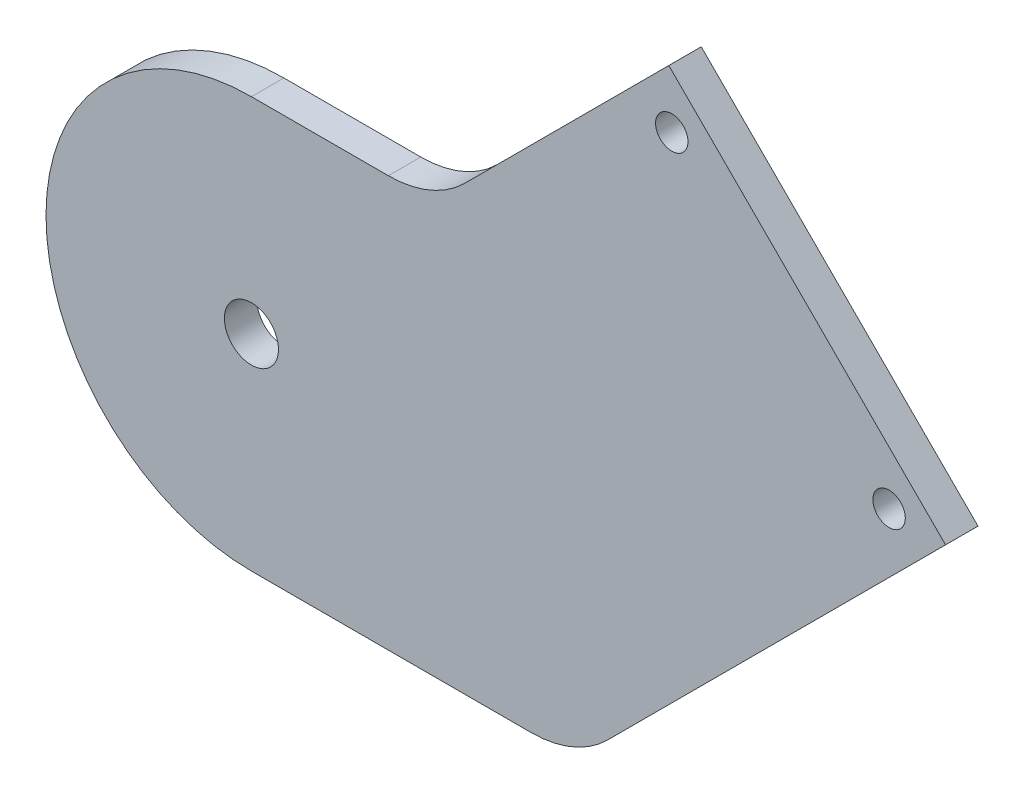
from build123d import *

# Parameters (mm, degrees)
SKETCH1_R           = 2.5
BOSS_EXTRUDE1_DEPTH = 3
SKETCH2_R           = 1.5
CUT_EXTRUDE1_DEPTH  = 77.127156728
FILLET1_R           = 10


with BuildPart() as part:
    # Sketch1 → Boss-Extrude1 (new body)
    with BuildSketch(Plane.XY):
        with BuildLine():
            Line((0, -19), (30, -19))
            Line((30, -19), (64.201367261, 15.201367261))
            Line((64.201367261, 15.201367261), (58.615223689, 20.787510832))
            Line((58.615223689, 20.787510832), (44.190245353, 35.212489168))
            Line((44.190245353, 35.212489168), (38.604101782, 40.798632739))
            Line((38.604101782, 40.798632739), (16.805469042, 19))
            Line((16.805469042, 19), (0, 19))
            ThreePointArc((0, 19), (-19, 0), (0, -19))
        make_face()
        Circle(SKETCH1_R, mode=Mode.SUBTRACT)
    extrude(amount=BOSS_EXTRUDE1_DEPTH)

    # Sketch2 → Cut-Extrude1 (cut, through all)
    with BuildSketch(Plane.XY.offset(3)):
        with Locations((38.878105659, 35.574881393)):
            Circle(SKETCH2_R)
        with Locations((58.977615915, 15.475371138)):
            Circle(SKETCH2_R)
    extrude(amount=-CUT_EXTRUDE1_DEPTH, mode=Mode.SUBTRACT)

    # Fillet1
    fillet1_edges = [part.edges().sort_by_distance(p)[0] for p in [
        (16.805469042, 19, 1.5),
        (30, -19, 1.5),
    ]]
    fillet(fillet1_edges, radius=FILLET1_R)


solid = part.part
